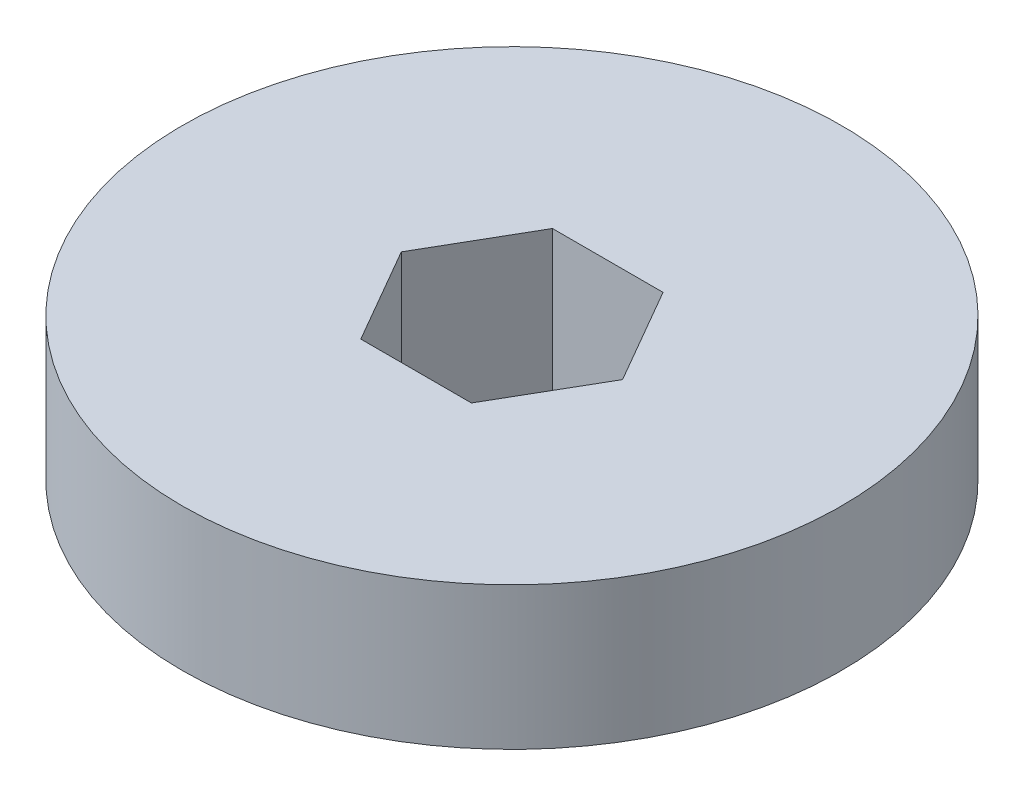
from build123d import *

# Parameters (mm, degrees)
SKETCH1_R           = 21.844
BOSS_EXTRUDE1_DEPTH = 9.4488


with BuildPart() as part:
    # Sketch1 → Boss-Extrude1 (new body)
    with BuildSketch(Plane(origin=(0, 0, 0), x_dir=(1, 0, 0), z_dir=(0, 1, 0))):
        with Locations(Location((0, 0, 0), (0, 0, 270))):
            Circle(SKETCH1_R)
        Polygon((-3.666174209, 6.35), (-7.332348419, 0), (-3.666174209, -6.35), (3.666174209, -6.35), (7.332348419, 0), (3.666174209, 6.35), align=None, mode=Mode.SUBTRACT)
    extrude(amount=BOSS_EXTRUDE1_DEPTH)


solid = part.part
